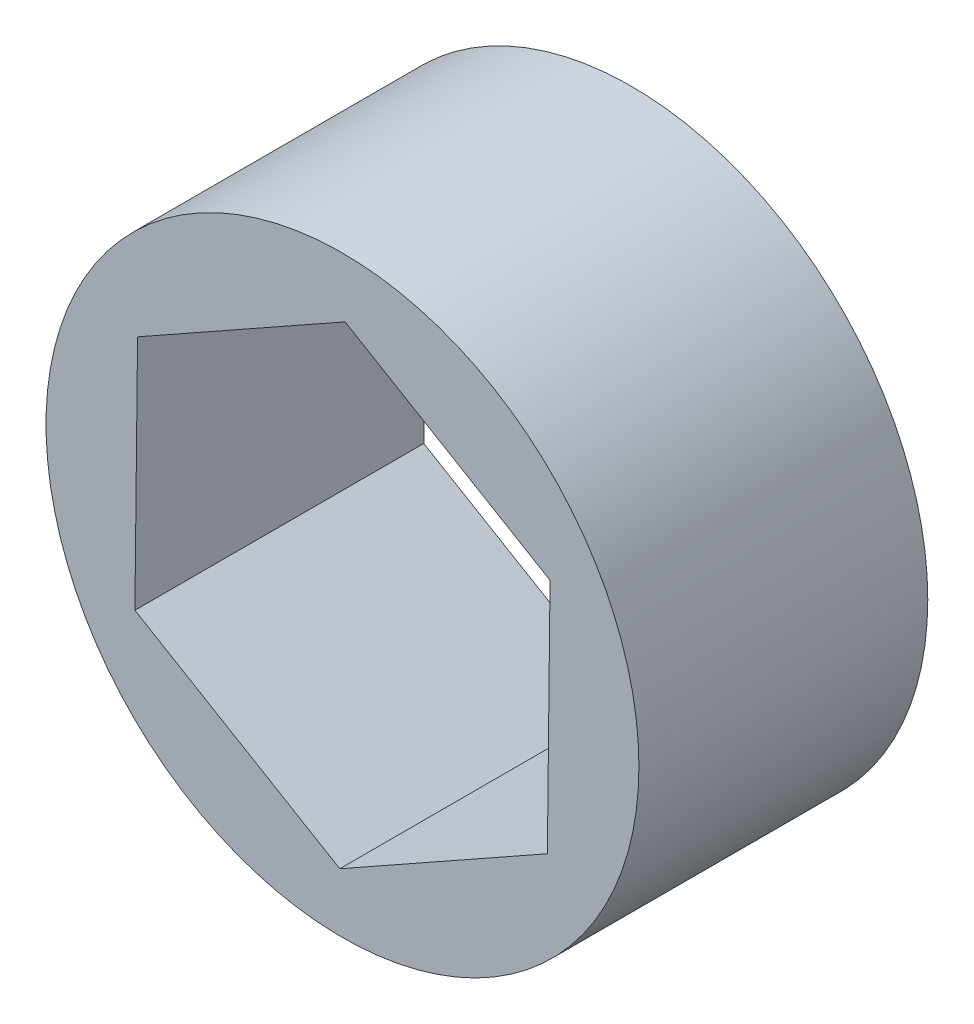
from build123d import *

# Parameters (mm, degrees)
CROQUIS1_R              = 9.4
SALIENTE_EXTRUIR2_DEPTH = 9.16


with BuildPart() as part:
    # Croquis1 → Saliente-Extruir2 (new body)
    with BuildSketch(Plane.XY):
        Circle(CROQUIS1_R)
        Polygon((6.497272807, -3.848927913), (6.581905753, 3.70233935), (0.084632946, 7.551267262), (-6.497272807, 3.848927913), (-6.581905753, -3.70233935), (-0.084632946, -7.551267262), align=None, mode=Mode.SUBTRACT)
    extrude(amount=SALIENTE_EXTRUIR2_DEPTH)


solid = part.part
